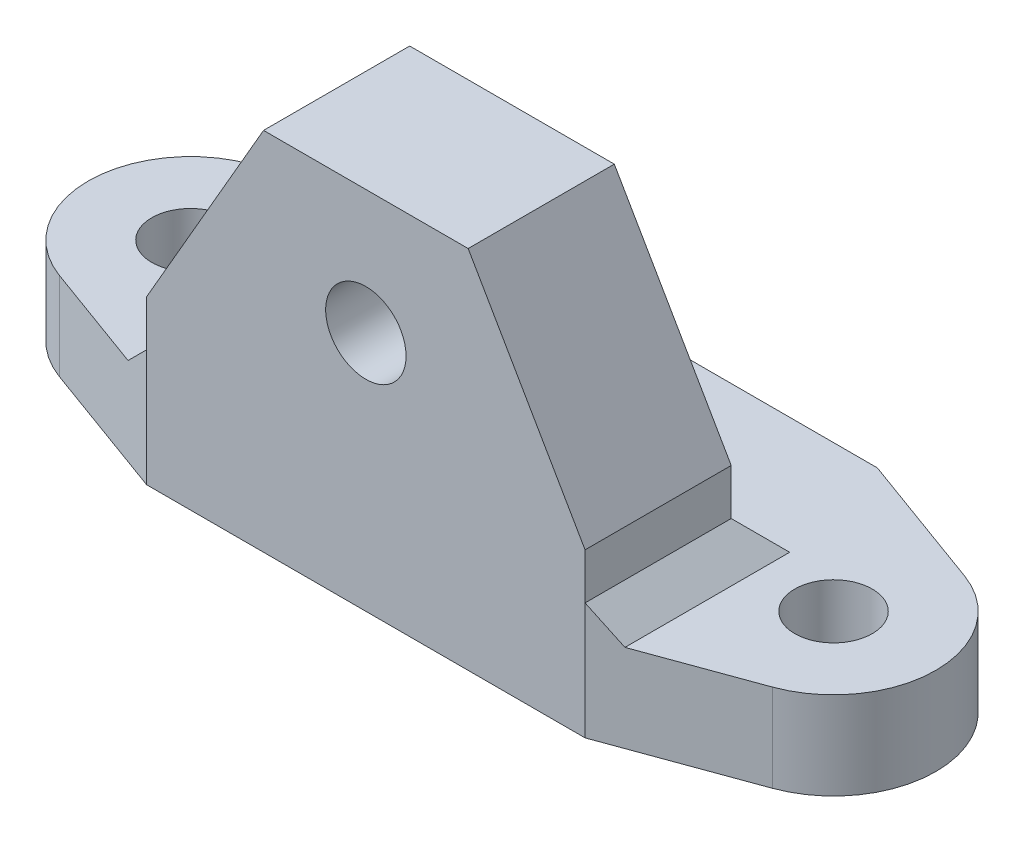
from build123d import *

# Parameters (mm, degrees)
SKETCH1_W           = 30
SKETCH1_H           = 25
BOSS_EXTRUDE1_DEPTH = 20
SKETCH2_R           = 5.25
CUT_EXTRUDE1_DEPTH  = 15
CUT_EXTRUDE2_REACH  = 29.951
SKETCH3_R           = 2.75
SKETCH4_R           = 2.65
BOSS_EXTRUDE2_DEPTH = 6
CHAMFER1_SIZE       = 8
CHAMFER1_SIZE2      = 13.856406461
SKETCH5_W           = 10
SKETCH5_H           = 19
CUT_EXTRUDE3_DEPTH  = 20
CHAMFER2_SIZE       = 2


with BuildPart() as part:
    # Sketch1 → Boss-Extrude1 (new body)
    with BuildSketch(Plane.XY):
        Rectangle(SKETCH1_W, SKETCH1_H)
    extrude(amount=BOSS_EXTRUDE1_DEPTH)

    # Sketch2 → Cut-Extrude1 (cut)
    with BuildSketch(Plane.XY):
        with Locations((0, 4)):
            Circle(SKETCH2_R)
    extrude(amount=CUT_EXTRUDE1_DEPTH, mode=Mode.SUBTRACT)

    # Sketch3 → Cut-Extrude2 (cut, up to next)
    with BuildSketch(Plane.XY, mode=Mode.PRIVATE) as cut_extrude2_sk1:
        with Locations((0, 4)):
            Circle(SKETCH3_R)
    cut_extrude2_tool1 = extrude(cut_extrude2_sk1.sketch, amount=CUT_EXTRUDE2_REACH, mode=Mode.PRIVATE) & part.part
    add(cut_extrude2_tool1.solids().sort_by_distance((0, 4, 0))[0], mode=Mode.SUBTRACT)

    # Sketch4 → Boss-Extrude2 (add)
    # profile 1 of 2: a face of its own
    with BuildSketch(Plane.XZ.offset(12.5)):
        with BuildLine():
            Line((-15, 20), (-24.395973154, 16.577181208))
            ThreePointArc((-24.395973154, 16.577181208), (-29, 10), (-24.395973154, 3.422818792))
            Line((-24.395973154, 3.422818792), (-15, 0))
            Line((-15, 0), (-15, 20))
        make_face()
        with Locations(Location((-22, 10, 0), (0, 0, 270))):
            Circle(SKETCH4_R, mode=Mode.SUBTRACT)
    # profile 2 of 2: a face of its own
    with BuildSketch(Plane.XZ.offset(12.5)):
        with BuildLine():
            Line((15, 0), (24.395973154, 3.422818792))
            ThreePointArc((24.395973154, 3.422818792), (29, 10), (24.395973154, 16.577181208))
            Line((24.395973154, 16.577181208), (15, 20))
            Line((15, 20), (15, 0))
        make_face()
        with Locations(Location((22, 10, 0), (0, 0, 90))):
            Circle(SKETCH4_R, mode=Mode.SUBTRACT)
    extrude(amount=-BOSS_EXTRUDE2_DEPTH)

    # Chamfer1
    chamfer1_edges = [part.edges().sort_by_distance(p)[0] for p in [
        (-15, 12.5, 10),
        (15, 12.5, 10),
    ]]
    chamfer1_side = [part.faces().sort_by_distance(p)[0] for p in [
        (0, 12.5, 10),
    ]]
    chamfer(chamfer1_edges, length=CHAMFER1_SIZE, length2=CHAMFER1_SIZE2, reference=chamfer1_side[0])

    # Sketch5 → Cut-Extrude3 (cut, symmetric)
    with BuildSketch(Plane(origin=(0, 0, 0), x_dir=(0, 0, -1), z_dir=(1, 0, 0))):
        with Locations((-5, 3)):
            Rectangle(SKETCH5_W, SKETCH5_H)
    extrude(amount=CUT_EXTRUDE3_DEPTH, both=True, mode=Mode.SUBTRACT)

    # Chamfer2
    chamfer2_edges = [part.edges().sort_by_distance(p)[0] for p in [
        (-15, -6.5, 15),
        (15, -6.5, 15),
        (0, -6.5, 10),
    ]]
    chamfer(chamfer2_edges, length=CHAMFER2_SIZE)


solid = part.part
